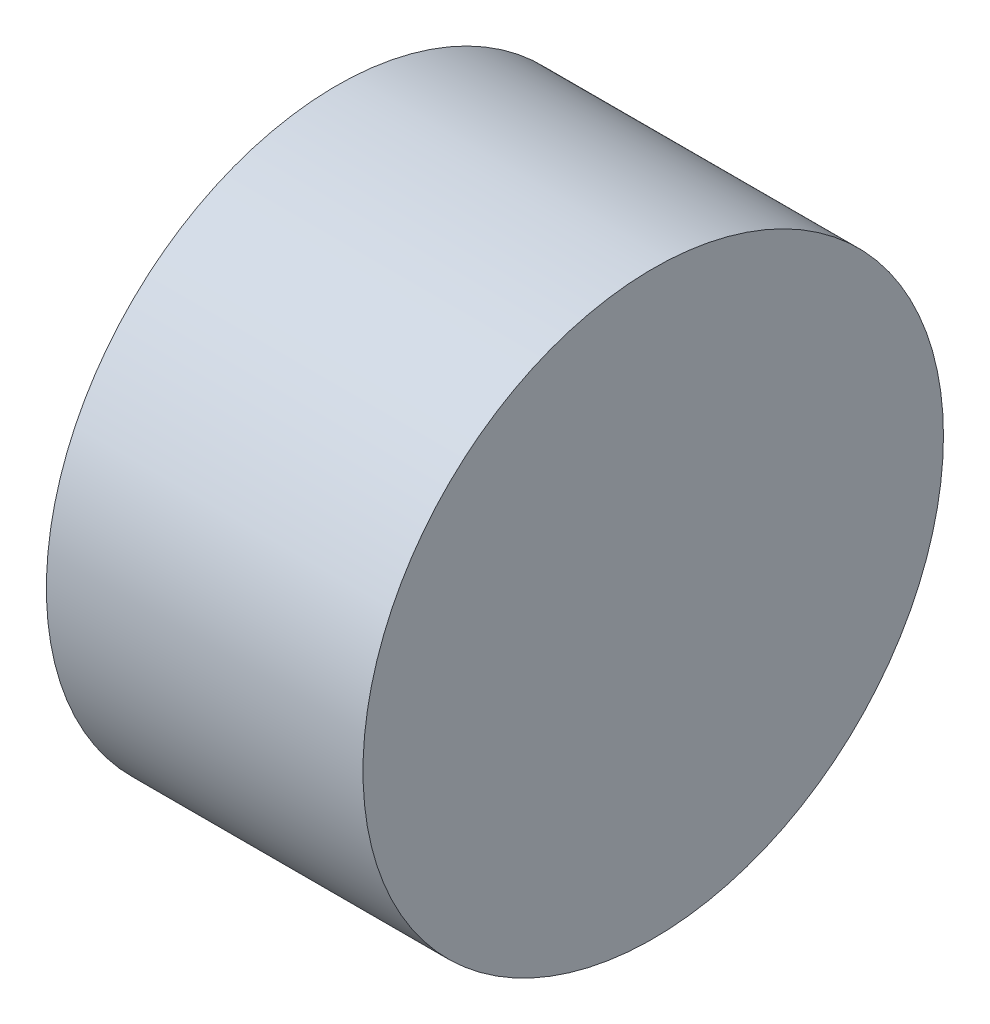
from build123d import *

# Parameters (mm, degrees)
SKETCH1_R           = 27.5
BOSS_EXTRUDE1_DEPTH = 30


with BuildPart() as part:
    # Sketch1 → Boss-Extrude1 (new body)
    with BuildSketch(Plane(origin=(0, 0, 0), x_dir=(0, 0, -1), z_dir=(1, 0, 0))):
        Circle(SKETCH1_R)
    extrude(amount=BOSS_EXTRUDE1_DEPTH)


solid = part.part
